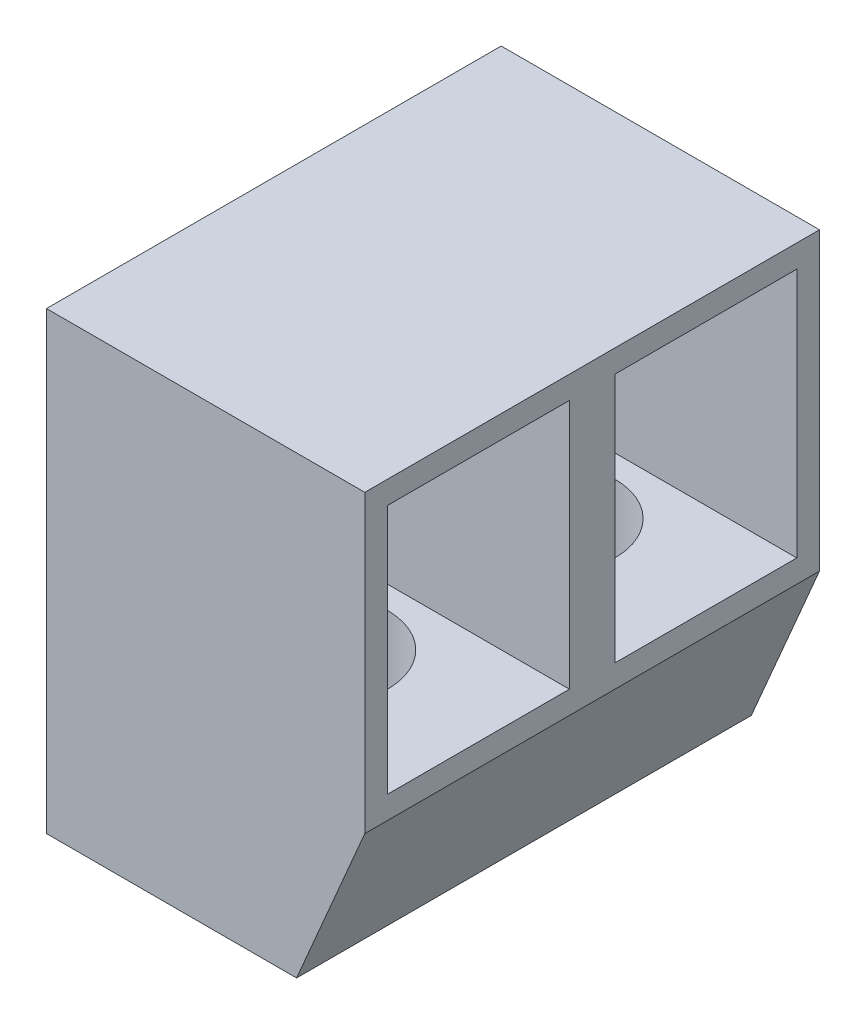
from build123d import *

# Parameters (mm, degrees)
BOSS_EXTRUDE1_DEPTH = 10
CUT_EXTRUDE1_REACH  = 17.78
SKETCH2_W           = 4
SKETCH2_H           = 5.5
CUT_EXTRUDE2_REACH  = 15.601
SKETCH3_R           = 1.5


with BuildPart() as part:
    # Sketch1 → Boss-Extrude1 (new body)
    with BuildSketch(Plane.XY):
        Polygon((0, 0), (0, 10), (7, 10), (7, 3.5), (5.5, 0), align=None)
    extrude(amount=BOSS_EXTRUDE1_DEPTH)

    # Sketch2 → Cut-Extrude1 (cut, up to next)
    with BuildSketch(Plane(origin=(7, 0, 0), x_dir=(0, 0, -1), z_dir=(1, 0, 0)), mode=Mode.PRIVATE) as cut_extrude1_sk1:
        with Locations((-7.5, 6.75)):
            Rectangle(SKETCH2_W, SKETCH2_H)
    cut_extrude1_tool1 = extrude(cut_extrude1_sk1.sketch, amount=-CUT_EXTRUDE1_REACH, mode=Mode.PRIVATE) & part.part
    # Sketch2 → Cut-Extrude1 (cut, up to next)
    with BuildSketch(Plane(origin=(7, 0, 0), x_dir=(0, 0, -1), z_dir=(1, 0, 0)), mode=Mode.PRIVATE) as cut_extrude1_sk2:
        with Locations((-2.5, 6.75)):
            Rectangle(SKETCH2_W, SKETCH2_H)
    cut_extrude1_tool2 = extrude(cut_extrude1_sk2.sketch, amount=-CUT_EXTRUDE1_REACH, mode=Mode.PRIVATE) & part.part
    add(cut_extrude1_tool1.solids().sort_by_distance((7, 6.75, 7.5))[0], mode=Mode.SUBTRACT)
    add(cut_extrude1_tool2.solids().sort_by_distance((7, 6.75, 2.5))[0], mode=Mode.SUBTRACT)

    # Sketch3 → Cut-Extrude2 (cut, up to next)
    with BuildSketch(Plane(origin=(0, 4, 0), x_dir=(1, 0, 0), z_dir=(0, 1, 0)), mode=Mode.PRIVATE) as cut_extrude2_sk1:
        with Locations(Location((3.5, -2.5, 0), (0, 0, 180))):
            Circle(SKETCH3_R)
    cut_extrude2_tool1 = extrude(cut_extrude2_sk1.sketch, amount=-CUT_EXTRUDE2_REACH, mode=Mode.PRIVATE) & part.part
    # Sketch3 → Cut-Extrude2 (cut, up to next)
    with BuildSketch(Plane(origin=(0, 4, 0), x_dir=(1, 0, 0), z_dir=(0, 1, 0)), mode=Mode.PRIVATE) as cut_extrude2_sk2:
        with Locations(Location((3.5, -7.5, 0), (0, 0, 180))):
            Circle(SKETCH3_R)
    cut_extrude2_tool2 = extrude(cut_extrude2_sk2.sketch, amount=-CUT_EXTRUDE2_REACH, mode=Mode.PRIVATE) & part.part
    add(cut_extrude2_tool1.solids().sort_by_distance((3.5, 4, 2.5))[0], mode=Mode.SUBTRACT)
    add(cut_extrude2_tool2.solids().sort_by_distance((3.5, 4, 7.5))[0], mode=Mode.SUBTRACT)


solid = part.part
